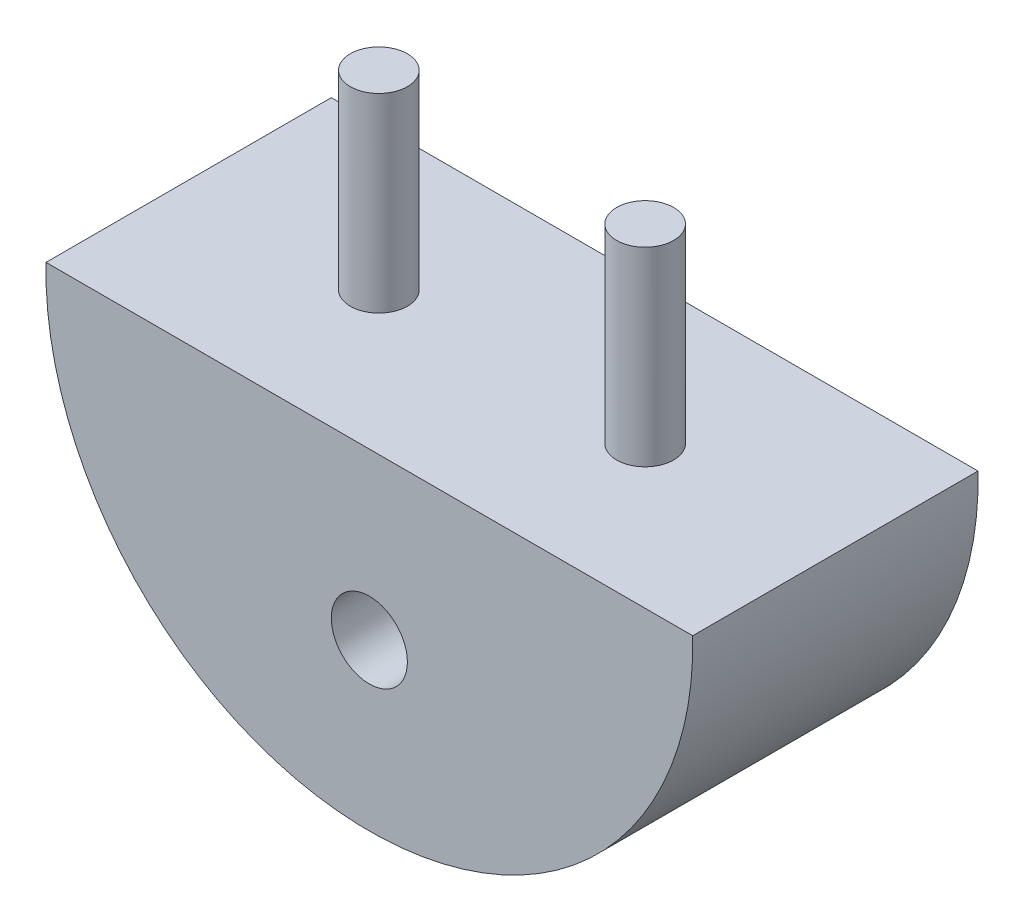
from build123d import *

# Parameters (mm, degrees)
SKETCH1_R           = 2
BOSS_EXTRUDE1_DEPTH = 15
SKETCH2_R           = 1.5
BOSS_EXTRUDE2_DEPTH = 10


with BuildPart() as part:
    # Sketch1 → Boss-Extrude1 (new body)
    with BuildSketch(Plane.XY):
        with BuildLine():
            Line((-16.33111253, 6.318244625), (17.66888747, 6.318244625))
            ThreePointArc((17.66888747, 6.318244625), (0.66888747, -11.07706784), (-16.33111253, 6.318244625))
        make_face()
        with Locations((0.66888747, -2.379411608)):
            Circle(SKETCH1_R, mode=Mode.SUBTRACT)
    extrude(amount=BOSS_EXTRUDE1_DEPTH)

    # Sketch2 → Boss-Extrude2 (add)
    with BuildSketch(Plane(origin=(0, 6.318244625, 0), x_dir=(1, 0, 0), z_dir=(0, 1, 0))):
        with Locations(Location((-6.33111253, -7.5, 0), (0, 0, 90))):
            Circle(SKETCH2_R)
        with Locations(Location((7.66888747, -7.5, 0), (0, 0, 90))):
            Circle(SKETCH2_R)
    extrude(amount=BOSS_EXTRUDE2_DEPTH)


solid = part.part
